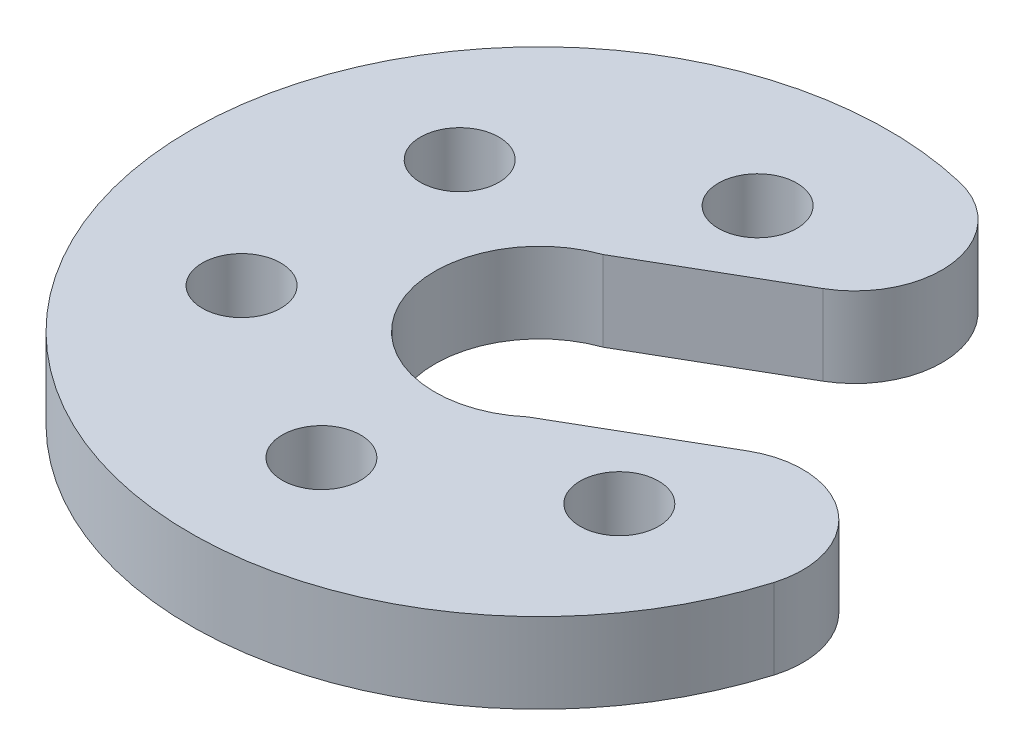
from build123d import *

# Parameters (mm, degrees)
SKETCH1_R               = 20
SKETCH1_R_2             = 6
SKETCH1_R_3             = 2.25
BOSS_EXTRUDE1_DEPTH     = 4.6
CUT_EXTRUDE1_DEPTH      = 29.655889447
CUT_EXTRUDE1_DEPTH_BACK = 29.655889447
SKETCH2_R               = 2.25
FILLET2_R               = 5


with BuildPart() as part:
    # Sketch1 → Boss-Extrude1 (new body)
    with BuildSketch(Plane(origin=(0, 0, 0), x_dir=(1, 0, 0), z_dir=(0, 1, 0))):
        with Locations(Location((0, 0, 0), (0, 0, 270))):
            Circle(SKETCH1_R)
        with Locations(Location((0, 0, 0), (0, 0, 270))):
            Circle(SKETCH1_R_2, mode=Mode.SUBTRACT)
        with Locations(Location((0, 12.5, 0), (0, 0, 270))):
            Circle(SKETCH1_R_3, mode=Mode.SUBTRACT)
        with Locations(Location((10.825317547, 6.25, 0), (0, 0, 270))):
            Circle(SKETCH1_R_3, mode=Mode.SUBTRACT)
        with Locations(Location((10.825317547, -6.25, 0), (0, 0, 270))):
            Circle(SKETCH1_R_3, mode=Mode.SUBTRACT)
        with Locations(Location((0, -12.5, 0), (0, 0, 270))):
            Circle(SKETCH1_R_3, mode=Mode.SUBTRACT)
        with Locations(Location((-10.825317547, -6.25, 0), (0, 0, 270))):
            Circle(SKETCH1_R_3, mode=Mode.SUBTRACT)
        with Locations(Location((-10.825317547, 6.25, 0), (0, 0, 270))):
            Circle(SKETCH1_R_3, mode=Mode.SUBTRACT)
    extrude(amount=BOSS_EXTRUDE1_DEPTH)

    # Sketch2 → Cut-Extrude1 (cut, two sides: drawn at the far end of the back side and taken through both)
    with BuildSketch(Plane(origin=(0, 4.6, 0), x_dir=(1, 0, 0), z_dir=(0, 1, 0)).offset(-CUT_EXTRUDE1_DEPTH_BACK)):
        with BuildLine():
            Line((13.599697882, 14.66452241), (-2.005277819, 5.654985488))
            ThreePointArc((-2.005277819, 5.654985488), (3.461815498, 4.900595214), (6, 0))
            ThreePointArc((6, 0), (5.448317772, -2.5131322), (3.894722181, -4.564114277))
            Line((3.894722181, -4.564114277), (19.499697882, 4.445422645))
            ThreePointArc((19.499697882, 4.445422645), (17.320508076, 10), (13.599697882, 14.66452241))
        make_face()
        with Locations((10.825317547, 6.25)):
            Circle(SKETCH2_R, mode=Mode.SUBTRACT)
    extrude(amount=CUT_EXTRUDE1_DEPTH + CUT_EXTRUDE1_DEPTH_BACK, mode=Mode.SUBTRACT)

    # Fillet2
    fillet2_edges = [part.edges().sort_by_distance(p)[0] for p in [
        (19.499697882, 2.3, -4.445422645),
        (13.599697882, 2.3, -14.66452241),
    ]]
    fillet(fillet2_edges, radius=FILLET2_R)


solid = part.part
